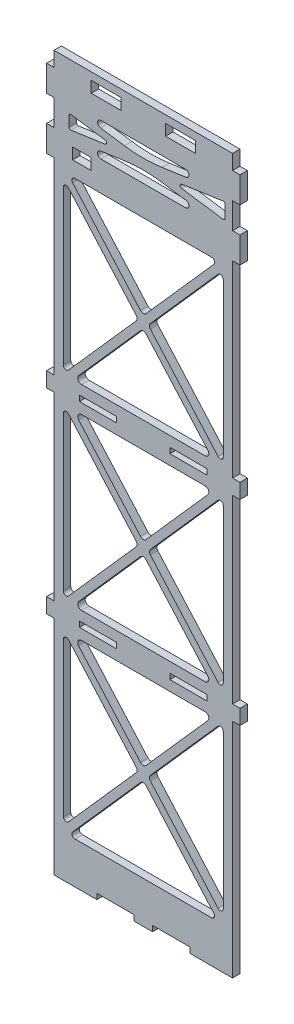
from build123d import *

# Parameters (mm, degrees)
SKETCH_1_W      = 5
SKETCH_1_H      = 3
SKETCH_1_W_2    = 8
EXTRUDE_1_DEPTH = 2


with BuildPart() as part:
    # 草图1 → 凸台-拉伸1 (new body)
    with BuildSketch(Plane.XY):
        Polygon((2550.986258479, 1406.108417532), (2502.986258479, 1406.108417532), (2502.986258479, 1402.108417532), (2500.986258479, 1402.108417532), (2500.986258479, 1395.108417532), (2502.986258479, 1395.108417532), (2502.986258479, 1388.108417532), (2500.986258479, 1388.108417532), (2500.986258479, 1381.108417532), (2502.986258479, 1381.108417532), (2502.986258479, 1330.508417532), (2500.986258479, 1330.508417532), (2500.986258479, 1326.508417532), (2502.986258479, 1326.508417532), (2502.986258479, 1277.908417532), (2500.986258479, 1277.908417532), (2500.986258479, 1273.908417532), (2502.986258479, 1273.908417532), (2502.986258479, 1214.108417532), (2514.486258479, 1214.108417532), (2514.486258479, 1215.608417532), (2524.486258479, 1215.608417532), (2524.486258479, 1214.858417532), (2524.486258479, 1214.108417532), (2529.486258479, 1214.108417532), (2529.486258479, 1214.858417532), (2529.486258479, 1215.608417532), (2539.486258479, 1215.608417532), (2539.486258479, 1214.108417532), (2550.986258479, 1214.108417532), (2550.986258479, 1273.908417532), (2552.986258479, 1273.908417532), (2552.986258479, 1277.908417532), (2550.986258479, 1277.908417532), (2550.986258479, 1326.508417532), (2552.986258479, 1326.508417532), (2552.986258479, 1330.508417532), (2550.986258479, 1330.508417532), (2550.986258479, 1381.108417532), (2552.986258479, 1381.108417532), (2552.986258479, 1388.108417532), (2550.986258479, 1388.108417532), (2550.986258479, 1395.108417532), (2552.986258479, 1395.108417532), (2552.986258479, 1402.108417532), (2550.986258479, 1402.108417532), align=None)
        with Locations((2510.486258479, 1384.608417532)):
            Rectangle(SKETCH_1_W, SKETCH_1_H, mode=Mode.SUBTRACT)
        with BuildLine():
            Line((2545.37503547, 1379.108417532), (2508.597481488, 1379.108417532))
            ThreePointArc((2508.597481488, 1379.108417532), (2507.868067393, 1378.636982714), (2507.998331302, 1377.778305228))
            Line((2507.998331302, 1377.778305228), (2523.241569819, 1360.549900765))
            Line((2523.241569819, 1360.549900765), (2524.087108293, 1359.594245652))
            Line((2524.087108293, 1359.594245652), (2526.237320747, 1357.16400553))
            ThreePointArc((2526.237320747, 1357.16400553), (2526.986258479, 1356.82664591), (2527.735196211, 1357.16400553))
            Line((2527.735196211, 1357.16400553), (2529.885408665, 1359.594245652))
            Line((2529.885408665, 1359.594245652), (2530.730947139, 1360.549900765))
            Line((2530.730947139, 1360.549900765), (2545.974185656, 1377.778305228))
            ThreePointArc((2545.974185656, 1377.778305228), (2546.104449565, 1378.636982714), (2545.37503547, 1379.108417532))
        make_face(mode=Mode.SUBTRACT)
        with BuildLine():
            Line((2508.885408665, 1373.757473133), (2525.064747235, 1355.471057913))
            ThreePointArc((2525.064747235, 1355.471057913), (2525.315809502, 1354.808417532), (2525.064747235, 1354.145777152))
            Line((2525.064747235, 1354.145777152), (2508.885408665, 1335.859361931))
            Line((2508.885408665, 1335.859361931), (2506.885408665, 1333.598896815))
            ThreePointArc((2506.885408665, 1333.598896815), (2506.002815494, 1333.380904799), (2505.486258479, 1334.129009119))
            Line((2505.486258479, 1334.129009119), (2505.486258479, 1354.808417532))
            Line((2505.486258479, 1354.808417532), (2505.486258479, 1375.487825946))
            ThreePointArc((2505.486258479, 1375.487825946), (2506.002815494, 1376.235930266), (2506.885408665, 1376.01793825))
            Line((2506.885408665, 1376.01793825), (2508.885408665, 1373.757473133))
        make_face(mode=Mode.SUBTRACT)
        with BuildLine():
            Line((2527.735196211, 1352.452829534), (2544.352813078, 1333.671057913))
            ThreePointArc((2544.352813078, 1333.671057913), (2544.515642965, 1332.597711056), (2543.603875346, 1332.008417532))
            Line((2543.603875346, 1332.008417532), (2526.986258479, 1332.008417532))
            Line((2526.986258479, 1332.008417532), (2510.368641612, 1332.008417532))
            ThreePointArc((2510.368641612, 1332.008417532), (2509.456873993, 1332.597711056), (2509.61970388, 1333.671057913))
            Line((2509.61970388, 1333.671057913), (2526.237320747, 1352.452829534))
            ThreePointArc((2526.237320747, 1352.452829534), (2526.986258479, 1352.790189154), (2527.735196211, 1352.452829534))
        make_face(mode=Mode.SUBTRACT)
        with BuildLine():
            Line((2528.907769723, 1354.145777152), (2545.087108293, 1335.859361931))
            Line((2545.087108293, 1335.859361931), (2547.087108293, 1333.598896815))
            ThreePointArc((2547.087108293, 1333.598896815), (2547.969701464, 1333.380904799), (2548.486258479, 1334.129009119))
            Line((2548.486258479, 1334.129009119), (2548.486258479, 1354.808417532))
            Line((2548.486258479, 1354.808417532), (2548.486258479, 1375.487825946))
            ThreePointArc((2548.486258479, 1375.487825946), (2547.969701464, 1376.235930266), (2547.087108293, 1376.01793825))
            Line((2547.087108293, 1376.01793825), (2545.087108293, 1373.757473133))
            Line((2545.087108293, 1373.757473133), (2528.907769723, 1355.471057913))
            ThreePointArc((2528.907769723, 1355.471057913), (2528.656707455, 1354.808417532), (2528.907769723, 1354.145777152))
        make_face(mode=Mode.SUBTRACT)
        Polygon((2519.828074215, 1327.758417532), (2519.828074215, 1328.508417532), (2519.828074215, 1329.258417532), (2509.828074215, 1329.258417532), (2509.828074215, 1327.758417532), align=None, mode=Mode.SUBTRACT)
        Polygon((2534.144442743, 1327.758417532), (2534.144442743, 1328.508417532), (2534.144442743, 1329.258417532), (2544.144442743, 1329.258417532), (2544.144442743, 1327.758417532), align=None, mode=Mode.SUBTRACT)
        with BuildLine():
            Line((2508.885408665, 1321.157473133), (2525.064747235, 1302.871057913))
            ThreePointArc((2525.064747235, 1302.871057913), (2525.315809502, 1302.208417532), (2525.064747235, 1301.545777152))
            Line((2525.064747235, 1301.545777152), (2508.885408665, 1283.259361931))
            Line((2508.885408665, 1283.259361931), (2506.885408665, 1280.998896815))
            ThreePointArc((2506.885408665, 1280.998896815), (2506.002815494, 1280.780904799), (2505.486258479, 1281.529009119))
            Line((2505.486258479, 1281.529009119), (2505.486258479, 1302.208417532))
            Line((2505.486258479, 1302.208417532), (2505.486258479, 1322.887825946))
            ThreePointArc((2505.486258479, 1322.887825946), (2506.002815494, 1323.635930266), (2506.885408665, 1323.41793825))
            Line((2506.885408665, 1323.41793825), (2508.885408665, 1321.157473133))
        make_face(mode=Mode.SUBTRACT)
        with BuildLine():
            Line((2527.735196211, 1299.852829534), (2544.352813078, 1281.071057913))
            ThreePointArc((2544.352813078, 1281.071057913), (2544.515642965, 1279.997711056), (2543.603875346, 1279.408417532))
            Line((2543.603875346, 1279.408417532), (2526.986258479, 1279.408417532))
            Line((2526.986258479, 1279.408417532), (2510.368641612, 1279.408417532))
            ThreePointArc((2510.368641612, 1279.408417532), (2509.456873993, 1279.997711056), (2509.61970388, 1281.071057913))
            Line((2509.61970388, 1281.071057913), (2526.237320747, 1299.852829534))
            ThreePointArc((2526.237320747, 1299.852829534), (2526.986258479, 1300.190189154), (2527.735196211, 1299.852829534))
        make_face(mode=Mode.SUBTRACT)
        with BuildLine():
            Line((2509.61970388, 1323.345777152), (2523.241569819, 1307.949900765))
            Line((2523.241569819, 1307.949900765), (2524.087108293, 1306.994245652))
            Line((2524.087108293, 1306.994245652), (2526.237320747, 1304.56400553))
            ThreePointArc((2526.237320747, 1304.56400553), (2526.986258479, 1304.22664591), (2527.735196211, 1304.56400553))
            Line((2527.735196211, 1304.56400553), (2529.885408665, 1306.994245652))
            Line((2529.885408665, 1306.994245652), (2530.730947139, 1307.949900765))
            Line((2530.730947139, 1307.949900765), (2544.352813078, 1323.345777152))
            ThreePointArc((2544.352813078, 1323.345777152), (2544.515642965, 1324.419124009), (2543.603875346, 1325.008417532))
            Line((2543.603875346, 1325.008417532), (2526.986258479, 1325.008417532))
            Line((2526.986258479, 1325.008417532), (2510.368641612, 1325.008417532))
            ThreePointArc((2510.368641612, 1325.008417532), (2509.456873993, 1324.419124009), (2509.61970388, 1323.345777152))
        make_face(mode=Mode.SUBTRACT)
        with BuildLine():
            Line((2528.907769723, 1301.545777152), (2545.087108293, 1283.259361931))
            Line((2545.087108293, 1283.259361931), (2547.087108293, 1280.998896815))
            ThreePointArc((2547.087108293, 1280.998896815), (2547.969701464, 1280.780904799), (2548.486258479, 1281.529009119))
            Line((2548.486258479, 1281.529009119), (2548.486258479, 1302.208417532))
            Line((2548.486258479, 1302.208417532), (2548.486258479, 1322.887825946))
            ThreePointArc((2548.486258479, 1322.887825946), (2547.969701464, 1323.635930266), (2547.087108293, 1323.41793825))
            Line((2547.087108293, 1323.41793825), (2545.087108293, 1321.157473133))
            Line((2545.087108293, 1321.157473133), (2528.907769723, 1302.871057913))
            ThreePointArc((2528.907769723, 1302.871057913), (2528.656707455, 1302.208417532), (2528.907769723, 1301.545777152))
        make_face(mode=Mode.SUBTRACT)
        Polygon((2519.828074215, 1276.658417532), (2519.828074215, 1275.908417532), (2519.828074215, 1275.158417532), (2509.828074215, 1275.158417532), (2509.828074215, 1276.658417532), align=None, mode=Mode.SUBTRACT)
        Polygon((2534.144442743, 1276.658417532), (2534.144442743, 1275.908417532), (2534.144442743, 1275.158417532), (2544.144442743, 1275.158417532), (2544.144442743, 1276.658417532), align=None, mode=Mode.SUBTRACT)
        with BuildLine():
            Line((2526.986258479, 1225.308417532), (2508.597481488, 1225.308417532))
            ThreePointArc((2508.597481488, 1225.308417532), (2507.868067393, 1225.779852351), (2507.998331302, 1226.638529836))
            Line((2507.998331302, 1226.638529836), (2526.237320747, 1247.252829534))
            ThreePointArc((2526.237320747, 1247.252829534), (2526.986258479, 1247.590189154), (2527.735196211, 1247.252829534))
            Line((2527.735196211, 1247.252829534), (2545.974185656, 1226.638529836))
            ThreePointArc((2545.974185656, 1226.638529836), (2546.104449565, 1225.779852351), (2545.37503547, 1225.308417532))
            Line((2545.37503547, 1225.308417532), (2526.986258479, 1225.308417532))
        make_face(mode=Mode.SUBTRACT)
        with BuildLine():
            Line((2508.885408665, 1268.557473133), (2525.064747235, 1250.271057913))
            ThreePointArc((2525.064747235, 1250.271057913), (2525.315809502, 1249.608417532), (2525.064747235, 1248.945777152))
            Line((2525.064747235, 1248.945777152), (2508.885408665, 1230.659361931))
            Line((2508.885408665, 1230.659361931), (2506.885408665, 1228.398896815))
            ThreePointArc((2506.885408665, 1228.398896815), (2506.002815494, 1228.180904799), (2505.486258479, 1228.929009119))
            Line((2505.486258479, 1228.929009119), (2505.486258479, 1249.608417532))
            Line((2505.486258479, 1249.608417532), (2505.486258479, 1270.287825946))
            ThreePointArc((2505.486258479, 1270.287825946), (2506.002815494, 1271.035930266), (2506.885408665, 1270.81793825))
            Line((2506.885408665, 1270.81793825), (2508.885408665, 1268.557473133))
        make_face(mode=Mode.SUBTRACT)
        with BuildLine():
            Line((2509.61970388, 1270.745777152), (2523.241569819, 1255.349900765))
            Line((2523.241569819, 1255.349900765), (2524.087108293, 1254.394245652))
            Line((2524.087108293, 1254.394245652), (2526.237320747, 1251.96400553))
            ThreePointArc((2526.237320747, 1251.96400553), (2526.986258479, 1251.62664591), (2527.735196211, 1251.96400553))
            Line((2527.735196211, 1251.96400553), (2529.885408665, 1254.394245652))
            Line((2529.885408665, 1254.394245652), (2530.730947139, 1255.349900765))
            Line((2530.730947139, 1255.349900765), (2544.352813078, 1270.745777152))
            ThreePointArc((2544.352813078, 1270.745777152), (2544.515642965, 1271.819124009), (2543.603875346, 1272.408417532))
            Line((2543.603875346, 1272.408417532), (2526.986258479, 1272.408417532))
            Line((2526.986258479, 1272.408417532), (2510.368641612, 1272.408417532))
            ThreePointArc((2510.368641612, 1272.408417532), (2509.456873993, 1271.819124009), (2509.61970388, 1270.745777152))
        make_face(mode=Mode.SUBTRACT)
        with BuildLine():
            Line((2528.907769723, 1248.945777152), (2545.087108293, 1230.659361931))
            Line((2545.087108293, 1230.659361931), (2547.087108293, 1228.398896815))
            ThreePointArc((2547.087108293, 1228.398896815), (2547.969701464, 1228.180904799), (2548.486258479, 1228.929009119))
            Line((2548.486258479, 1228.929009119), (2548.486258479, 1249.608417532))
            Line((2548.486258479, 1249.608417532), (2548.486258479, 1270.287825946))
            ThreePointArc((2548.486258479, 1270.287825946), (2547.969701464, 1271.035930266), (2547.087108293, 1270.81793825))
            Line((2547.087108293, 1270.81793825), (2545.087108293, 1268.557473133))
            Line((2545.087108293, 1268.557473133), (2528.907769723, 1250.271057913))
            ThreePointArc((2528.907769723, 1250.271057913), (2528.656707455, 1249.608417532), (2528.907769723, 1248.945777152))
        make_face(mode=Mode.SUBTRACT)
        with Locations((2516.986258479, 1402.608417532)):
            Rectangle(SKETCH_1_W_2, SKETCH_1_H, mode=Mode.SUBTRACT)
        with Locations((2536.986258479, 1402.608417532)):
            Rectangle(SKETCH_1_W_2, SKETCH_1_H, mode=Mode.SUBTRACT)
        with BuildLine():
            Line((2548.415061726, 1393.722874539), (2537.307943841, 1392.103086759))
            ThreePointArc((2537.307943841, 1392.103086759), (2536.880761231, 1391.608082078), (2537.307943841, 1391.113748305))
            Line((2537.307943841, 1391.113748305), (2548.415061726, 1389.493960525))
            ThreePointArc((2548.415061726, 1389.493960525), (2548.81367383, 1389.610977791), (2548.986258479, 1389.988865589))
            Line((2548.986258479, 1389.988865589), (2548.986258479, 1393.227969475))
            ThreePointArc((2548.986258479, 1393.227969475), (2548.813673829, 1393.605857274), (2548.415061726, 1393.722874539))
        make_face(mode=Mode.SUBTRACT)
        with BuildLine():
            Line((2521.935517184, 1389.861274877), (2515.482167187, 1388.920161478))
            ThreePointArc((2515.482167187, 1388.920161478), (2514.709936649, 1387.95891536), (2515.612798658, 1387.119168794))
            Line((2515.612798658, 1387.119168794), (2538.359718256, 1387.119168794))
            ThreePointArc((2538.359718256, 1387.119168794), (2539.262580265, 1387.95891536), (2538.490349727, 1388.920161478))
            Line((2538.490349727, 1388.920161478), (2532.036999699, 1389.861274659))
            ThreePointArc((2532.036999699, 1389.861274659), (2526.986258449, 1390.227620431), (2521.935517184, 1389.861274877))
        make_face(mode=Mode.SUBTRACT)
        with BuildLine():
            Line((2538.491292755, 1394.296811618), (2532.036999699, 1393.355560405))
            ThreePointArc((2532.036999699, 1393.355560405), (2526.986258449, 1392.989214634), (2521.935517184, 1393.355560187))
            Line((2521.935517184, 1393.355560187), (2515.482167187, 1394.296673586))
            ThreePointArc((2515.482167187, 1394.296673586), (2514.709936649, 1395.257919704), (2515.612798658, 1396.09766627))
            Line((2515.612798658, 1396.09766627), (2538.359718256, 1396.09766627))
            ThreePointArc((2538.359718256, 1396.09766627), (2539.262545666, 1395.258394984), (2538.491292755, 1394.296811618))
        make_face(mode=Mode.SUBTRACT)
        with BuildLine():
            Line((2516.663909253, 1391.113651043), (2507.558411893, 1389.785765811))
            ThreePointArc((2507.558411893, 1389.785765811), (2507.159208537, 1389.902328169), (2506.986258435, 1390.2805323))
            Line((2506.986258435, 1390.2805323), (2506.986258435, 1392.936302765))
            ThreePointArc((2506.986258435, 1392.936302765), (2507.159208537, 1393.314506895), (2507.558411893, 1393.431069254))
            Line((2507.558411893, 1393.431069254), (2516.663909253, 1392.103184021))
            ThreePointArc((2516.663909253, 1392.103184021), (2517.091755796, 1391.608417532), (2516.663909253, 1391.113651043))
        make_face(mode=Mode.SUBTRACT)
    extrude(amount=EXTRUDE_1_DEPTH)


solid = part.part
